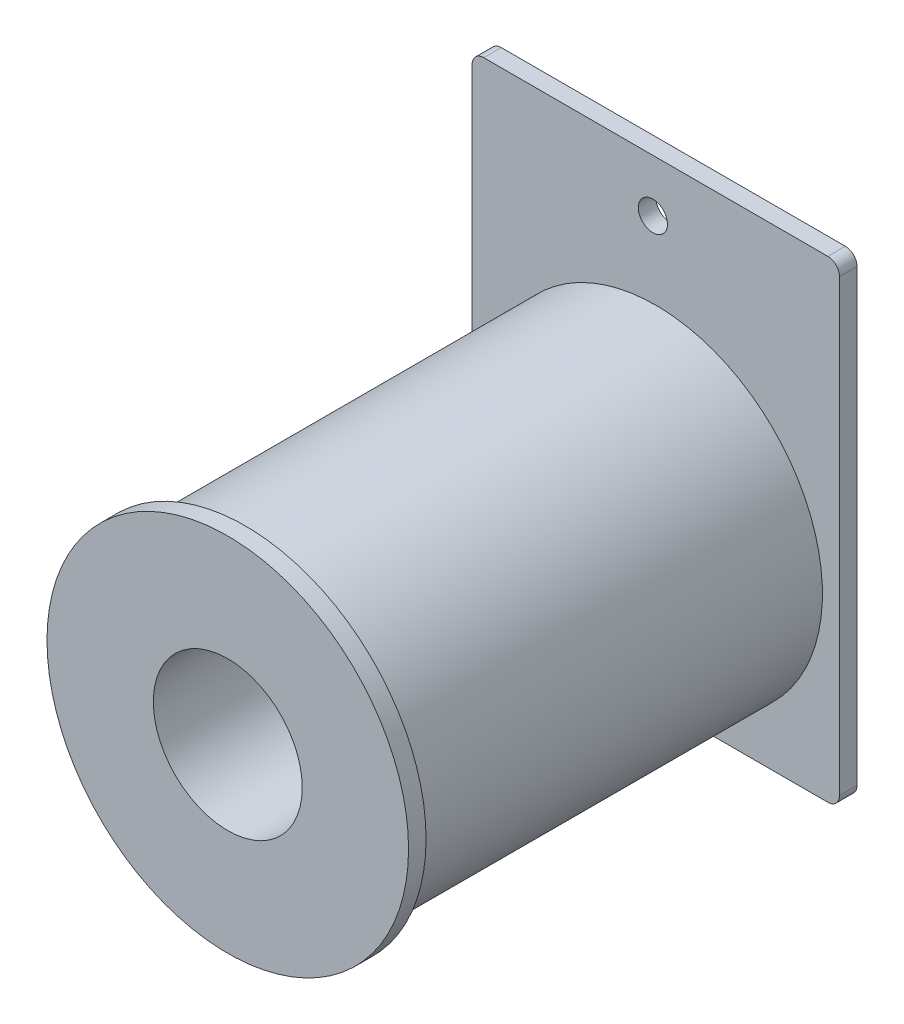
from build123d import *

# Parameters (mm, degrees)
ESQUISSE1_R             = 14.285
BOSS_EXTRU_1_DEPTH      = 35.2
ESQUISSE2_R             = 15.5
BOSS_EXTRU_2_DEPTH      = 1.5
BOSS_EXTRU_3_DEPTH      = 1.5
ESQUISSE3_R             = 6.385
ESQUISSE3_R_2           = 1.25
ENL_V_MAT_EXTRU_1_DEPTH = 49.442065656


with BuildPart() as part:
    # Esquisse1 → Boss.-Extru.1 (new body)
    with BuildSketch(Plane.XY):
        Circle(ESQUISSE1_R)
    extrude(amount=BOSS_EXTRU_1_DEPTH)

    # Esquisse2 → Boss.-Extru.2 (add)
    with BuildSketch(Plane.XY.offset(35.2)):
        Circle(ESQUISSE2_R)
    extrude(amount=BOSS_EXTRU_2_DEPTH)

    # Esquisse4 → Boss.-Extru.3 (add)
    with BuildSketch(Plane(origin=(0, 0, 0), x_dir=(-1, 0, 0), z_dir=(0, 0, -1))):
        with BuildLine():
            Line((-14.75, 25.285), (14.75, 25.285))
            ThreePointArc((14.75, 25.285), (15.457106781, 24.992106781), (15.75, 24.285))
            Line((15.75, 24.285), (15.75, -14.255))
            ThreePointArc((15.75, -14.255), (15.457106781, -14.962106781), (14.75, -15.255))
            Line((14.75, -15.255), (-14.75, -15.255))
            ThreePointArc((-14.75, -15.255), (-15.457106781, -14.962106781), (-15.75, -14.255))
            Line((-15.75, -14.255), (-15.75, 24.285))
            ThreePointArc((-15.75, 24.285), (-15.457106781, 24.992106781), (-14.75, 25.285))
        make_face()
    extrude(amount=BOSS_EXTRU_3_DEPTH)

    # Esquisse3 → Enlèv. mat.-Extru.1 (cut, through all)
    with BuildSketch(Plane.XY.offset(36.7)):
        Circle(ESQUISSE3_R)
        with Locations((-0.25, 20.785)):
            Circle(ESQUISSE3_R_2)
    extrude(amount=-ENL_V_MAT_EXTRU_1_DEPTH, mode=Mode.SUBTRACT)


solid = part.part
